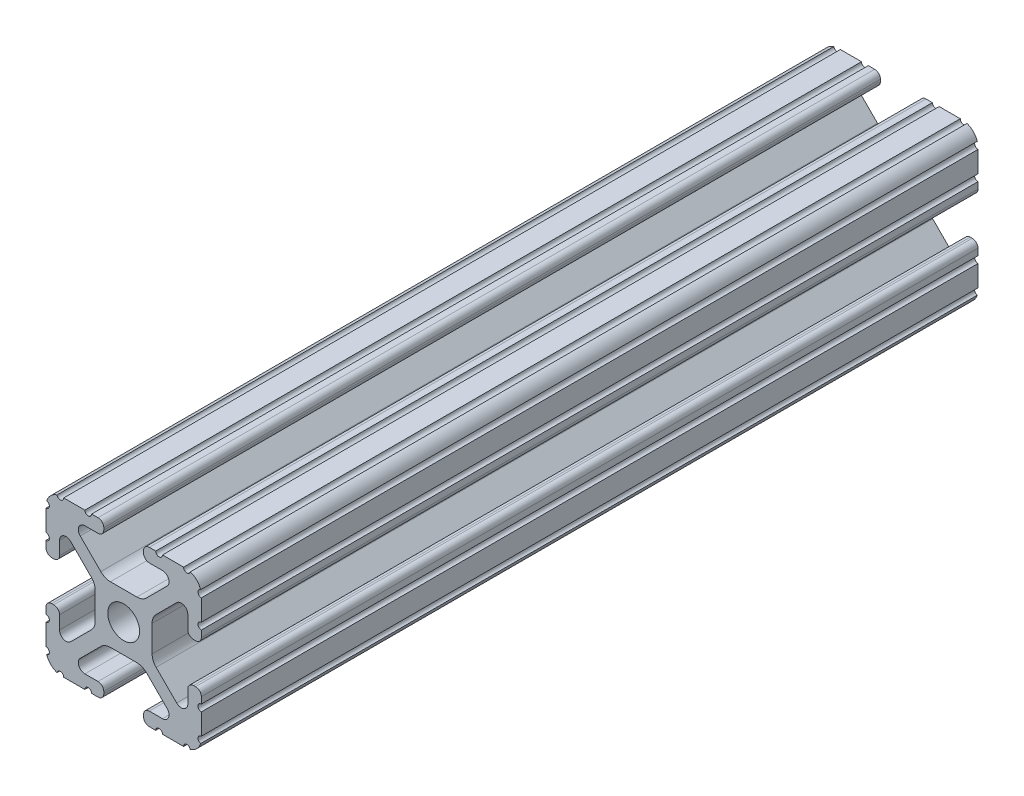
from build123d import *

# Parameters (mm, degrees)
BOSS_EXTRUDE1_START     = -63.5
BOSS_EXTRUDE1_DEPTH     = 127
CUT_EXTRUDE1_DEPTH      = 66.991135768
CUT_EXTRUDE1_DEPTH_BACK = 66.991135768
SKETCH5_R               = 0.55245


with BuildPart() as part:
    # Sketch4 → Boss-Extrude1 (new body)
    with BuildSketch(Plane.XY.offset(BOSS_EXTRUDE1_START)):
        with BuildLine():
            Line((4.190365, -12.7), (10.11729625, -12.7))
            ThreePointArc((10.11729625, -12.7), (11.943543585, -11.943543585), (12.7, -10.11729625))
            Line((12.7, -10.11729625), (12.7, -4.190365))
            ThreePointArc((12.7, -4.190365), (12.42492494, -3.52627506), (11.760835, -3.2512))
            Line((11.760835, -3.2512), (11.429365, -3.2512))
            ThreePointArc((11.429365, -3.2512), (10.76527506, -3.52627506), (10.4902, -4.190365))
            Line((10.4902, -4.190365), (10.4902, -6.348478019))
            ThreePointArc((10.4902, -6.348478019), (9.830707141, -7.335478831), (8.666460301, -7.103895736))
            Line((8.666460301, -7.103895736), (5.299899128, -3.737334563))
            ThreePointArc((5.299899128, -3.737334563), (4.817571085, -3.015479634), (4.6482, -2.16399369))
            Line((4.6482, -2.16399369), (4.6482, 0))
            Line((4.6482, 0), (2.6035, 0))
            ThreePointArc((2.6035, 0), (1.840952505, -1.840952505), (0, -2.6035))
            Line((0, -2.6035), (0, -4.6482))
            Line((0, -4.6482), (2.16399369, -4.6482))
            ThreePointArc((2.16399369, -4.6482), (3.015479634, -4.817571085), (3.737334563, -5.299899128))
            Line((3.737334563, -5.299899128), (7.103895736, -8.666460301))
            ThreePointArc((7.103895736, -8.666460301), (7.335478831, -9.830707141), (6.348478019, -10.4902))
            Line((6.348478019, -10.4902), (4.190365, -10.4902))
            ThreePointArc((4.190365, -10.4902), (3.52627506, -10.76527506), (3.2512, -11.429365))
            Line((3.2512, -11.429365), (3.2512, -11.760835))
            ThreePointArc((3.2512, -11.760835), (3.52627506, -12.42492494), (4.190365, -12.7))
        make_face()
    extrude(amount=BOSS_EXTRUDE1_DEPTH)

    # Sketch5 → Cut-Extrude1 (cut, two sides: drawn at the far end of the back side and taken through both)
    with BuildSketch(Plane.XY.offset(-CUT_EXTRUDE1_DEPTH_BACK)):
        with Locations((10.356153152, -12.7)):
            Circle(SKETCH5_R)
        with Locations((5.796028019, -12.7)):
            Circle(SKETCH5_R)
        with Locations((12.7, -10.356153152)):
            Circle(SKETCH5_R)
        with Locations((12.7, -5.796028019)):
            Circle(SKETCH5_R)
    extrude(amount=CUT_EXTRUDE1_DEPTH + CUT_EXTRUDE1_DEPTH_BACK, mode=Mode.SUBTRACT)

    # Mirror1: part across plane


with BuildPart() as part_1:
    add(part.part)
    add(part.part.mirror(Plane(origin=(0, 0, 0), x_dir=(0, 0, 1), z_dir=(1, 0, 0))))

    # Mirror2: part across plane


with BuildPart() as part_2:
    add(part_1.part)
    add(part_1.part.mirror(Plane.ZX))


solid = part_2.part
